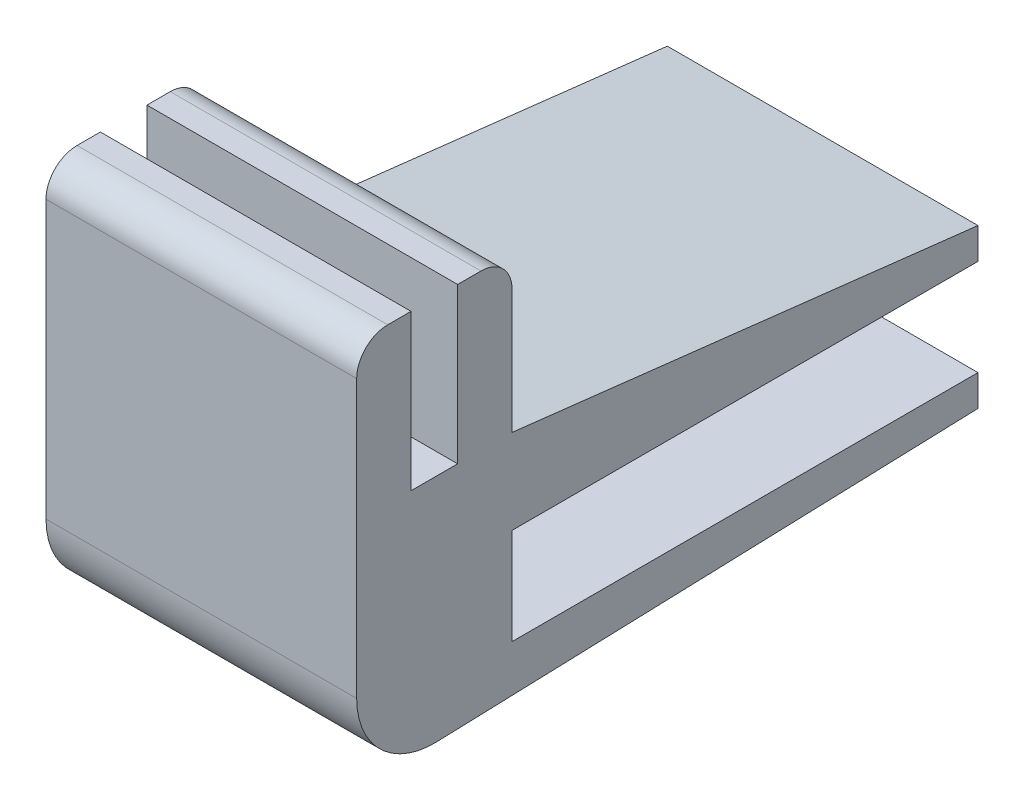
from build123d import *

# Parameters (mm, degrees)
BOSS_EXTRU_1_DEPTH = 20


with BuildPart() as part:
    # Esquisse1 → Boss.-Extru.1 (new body)
    with BuildSketch(Plane(origin=(0, 0, 0), x_dir=(0, 0, -1), z_dir=(1, 0, 0))):
        with BuildLine():
            Line((5.166852316, 0.172516338), (40, 1.335562371))
            Line((40, 1.335562371), (40, 3.335562371))
            Line((40, 3.335562371), (10, 3.335562371))
            Line((10, 3.335562371), (10, 9.535562371))
            Line((10, 9.535562371), (40, 9.535562371))
            Line((40, 9.535562371), (40, 11.535562371))
            Line((40, 11.535562371), (10, 15))
            Line((10, 15), (10, 23))
            ThreePointArc((10, 23), (9.414213562, 24.414213562), (8, 25))
            Line((8, 25), (6.5, 25))
            Line((6.5, 25), (6.5, 15))
            Line((6.5, 15), (3.5, 15))
            Line((3.5, 15), (3.5, 25))
            Line((3.5, 25), (2, 25))
            ThreePointArc((2, 25), (0.585786438, 24.414213562), (0, 23))
            Line((0, 23), (0, 15))
            Line((0, 15), (0, 5.169731593))
            ThreePointArc((0, 5.169731593), (1.523957824, 1.575690582), (5.166852316, 0.172516338))
        make_face()
    extrude(amount=BOSS_EXTRU_1_DEPTH)


solid = part.part
